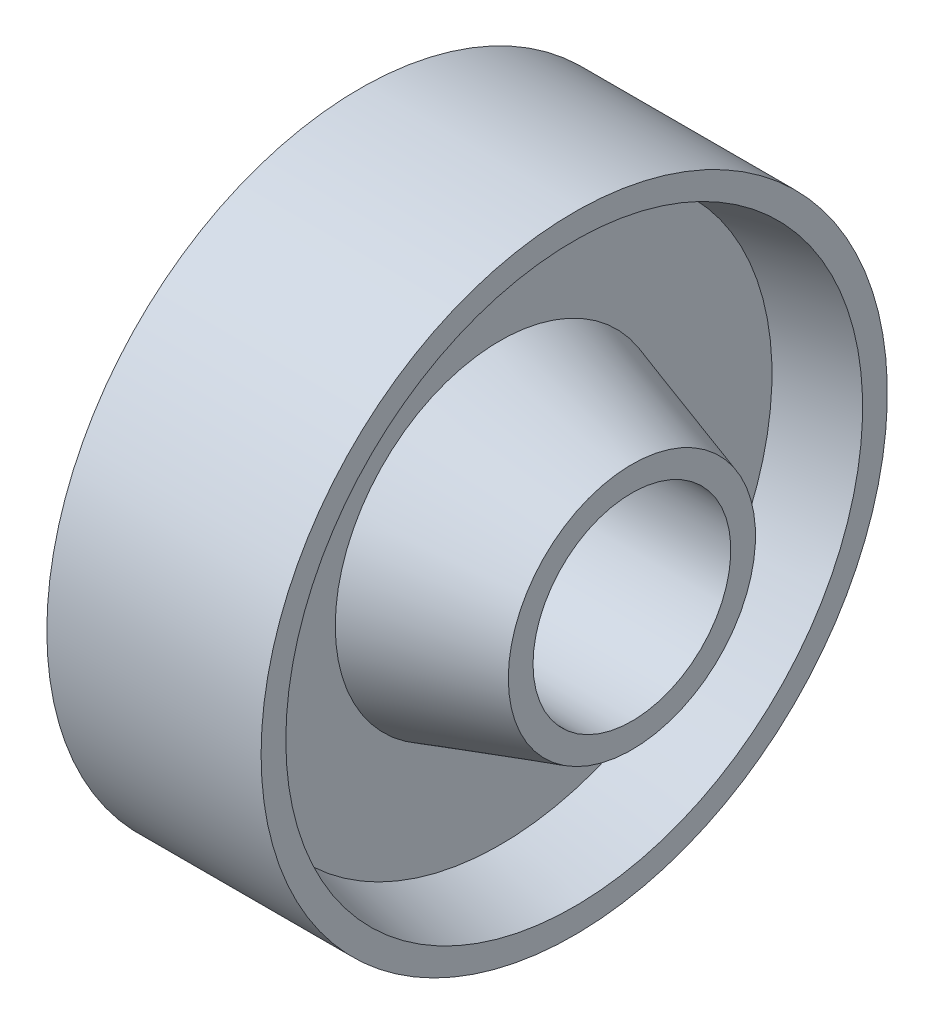
from build123d import *


with BuildPart() as part:
    # Sketch1 → Revolve1 (revolve)
    with BuildSketch(Plane.XY, mode=Mode.PRIVATE) as revolve1_sk:
        Polygon((20, 12), (-20, 12), (-20, 15), (-4, 20), (-4, 33), (-13, 35), (-13, 38), (13, 38), (13, 35), (4, 33), (4, 20), (20, 15), align=None)
    revolve(revolve1_sk.sketch.rotate(Axis((0, 0, 0), (1, 0, 0)), 90), axis=Axis((0, 0, 0), (1, 0, 0)))


solid = part.part
